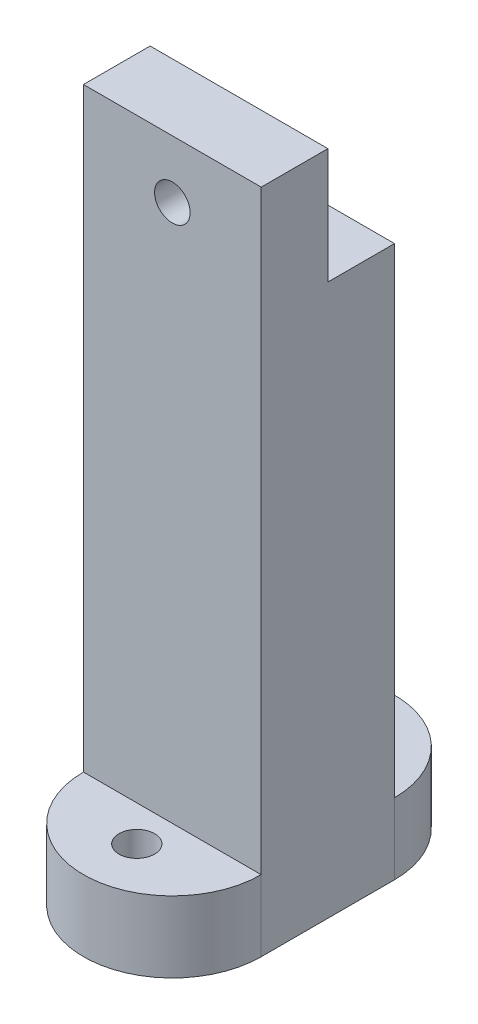
from build123d import *

# Parameters (mm, degrees)
SKETCH1_W           = 20
SKETCH1_H           = 75
BOSS_EXTRUDE1_DEPTH = 15
SKETCH2_R           = 2
BOSS_EXTRUDE2_DEPTH = 8
SKETCH3_W           = 20
SKETCH3_H           = 7.5
CUT_EXTRUDE1_DEPTH  = 13
SKETCH4_R           = 2
CUT_EXTRUDE2_DEPTH  = 13


with BuildPart() as part:
    # Sketch1 → Boss-Extrude1 (new body)
    with BuildSketch(Plane.XY):
        Rectangle(SKETCH1_W, SKETCH1_H)
    extrude(amount=BOSS_EXTRUDE1_DEPTH)

    # Sketch2 → Boss-Extrude2 (add)
    # profile 1 of 2: a face of its own
    with BuildSketch(Plane.XZ.offset(37.5)):
        with BuildLine():
            Line((-10, 0), (10, 0))
            ThreePointArc((10, 0), (0, -10), (-10, 0))
        make_face()
        with Locations(Location((0, -4, 0), (0, 0, 270))):
            Circle(SKETCH2_R, mode=Mode.SUBTRACT)
    # profile 2 of 2: a face of its own
    with BuildSketch(Plane.XZ.offset(37.5)):
        with BuildLine():
            Line((-10, 15), (10, 15))
            ThreePointArc((10, 15), (0, 25), (-10, 15))
        make_face()
        with Locations(Location((0, 19, 0), (0, 0, 90))):
            Circle(SKETCH2_R, mode=Mode.SUBTRACT)
    extrude(amount=-BOSS_EXTRUDE2_DEPTH)

    # Sketch3 → Cut-Extrude1 (cut)
    with BuildSketch(Plane(origin=(0, 37.5, 0), x_dir=(1, 0, 0), z_dir=(0, 1, 0))):
        with Locations((0, -3.75)):
            Rectangle(SKETCH3_W, SKETCH3_H)
    extrude(amount=-CUT_EXTRUDE1_DEPTH, mode=Mode.SUBTRACT)

    # Sketch4 → Cut-Extrude2 (cut)
    with BuildSketch(Plane(origin=(0, 0, 7.5), x_dir=(-1, 0, 0), z_dir=(0, 0, -1))):
        with Locations((0, 31)):
            Circle(SKETCH4_R)
    extrude(amount=-CUT_EXTRUDE2_DEPTH, mode=Mode.SUBTRACT)


solid = part.part
